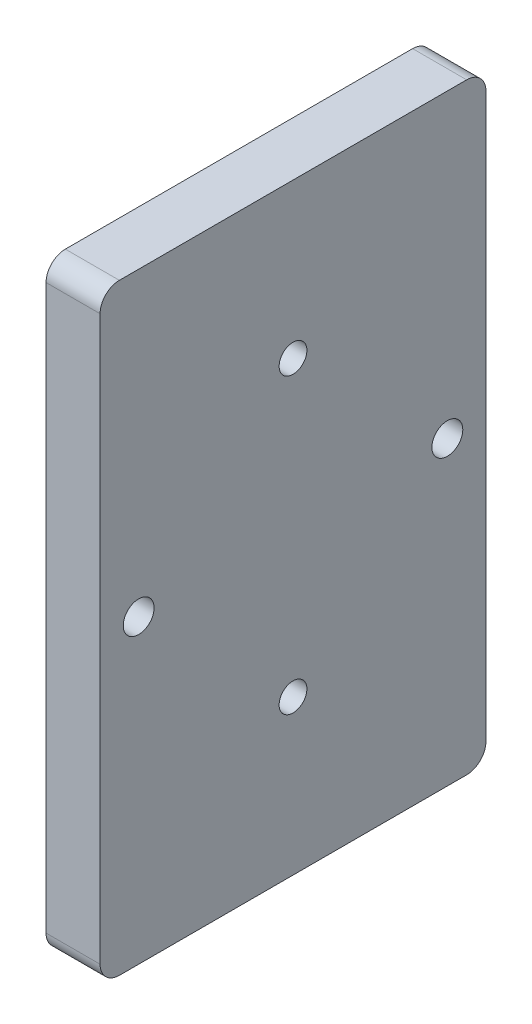
from build123d import *

# Parameters (mm, degrees)
SKETCH1_W           = 100
SKETCH1_H           = 156
SKETCH1_R           = 4
SKETCH1_R_2         = 3.6
BOSS_EXTRUDE1_DEPTH = 14
FILLET1_R           = 5
SKETCH1_3_R         = 7
SKETCH1_3_R_2       = 3.6
CUT_EXTRUDE1_DEPTH  = 8


with BuildPart() as part:
    # Sketch1 → Boss-Extrude1 (new body)
    with BuildSketch(Plane(origin=(0, 0, 0), x_dir=(0, 0, -1), z_dir=(1, 0, 0))):
        with Locations((50, 78)):
            Rectangle(SKETCH1_W, SKETCH1_H)
        with Locations((10, 78)):
            Circle(SKETCH1_R, mode=Mode.SUBTRACT)
        with Locations((90, 78)):
            Circle(SKETCH1_R, mode=Mode.SUBTRACT)
        with Locations((50, 40)):
            Circle(SKETCH1_R_2, mode=Mode.SUBTRACT)
        with Locations((50, 116)):
            Circle(SKETCH1_R_2, mode=Mode.SUBTRACT)
    extrude(amount=BOSS_EXTRUDE1_DEPTH)

    # Fillet1
    fillet1_edges = [part.edges().sort_by_distance(p)[0] for p in [
        (7, 156, -100),
        (7, 156, 0),
        (7, 0, 0),
        (7, 0, -100),
    ]]
    fillet(fillet1_edges, radius=FILLET1_R)

    # Sketch1<3> → Cut-Extrude1 (cut)
    # profile 1 of 2: a face of its own
    with BuildSketch(Plane(origin=(0, 0, 0), x_dir=(0, 0, -1), z_dir=(1, 0, 0))):
        with Locations((50, 116)):
            Circle(SKETCH1_3_R)
        with Locations((50, 116)):
            Circle(SKETCH1_3_R_2, mode=Mode.SUBTRACT)
    # profile 2 of 2: a face of its own
    with BuildSketch(Plane(origin=(0, 0, 0), x_dir=(0, 0, -1), z_dir=(1, 0, 0))):
        with Locations((50, 40)):
            Circle(SKETCH1_3_R)
        with Locations((50, 40)):
            Circle(SKETCH1_3_R_2, mode=Mode.SUBTRACT)
    extrude(amount=CUT_EXTRUDE1_DEPTH, mode=Mode.SUBTRACT)


solid = part.part
